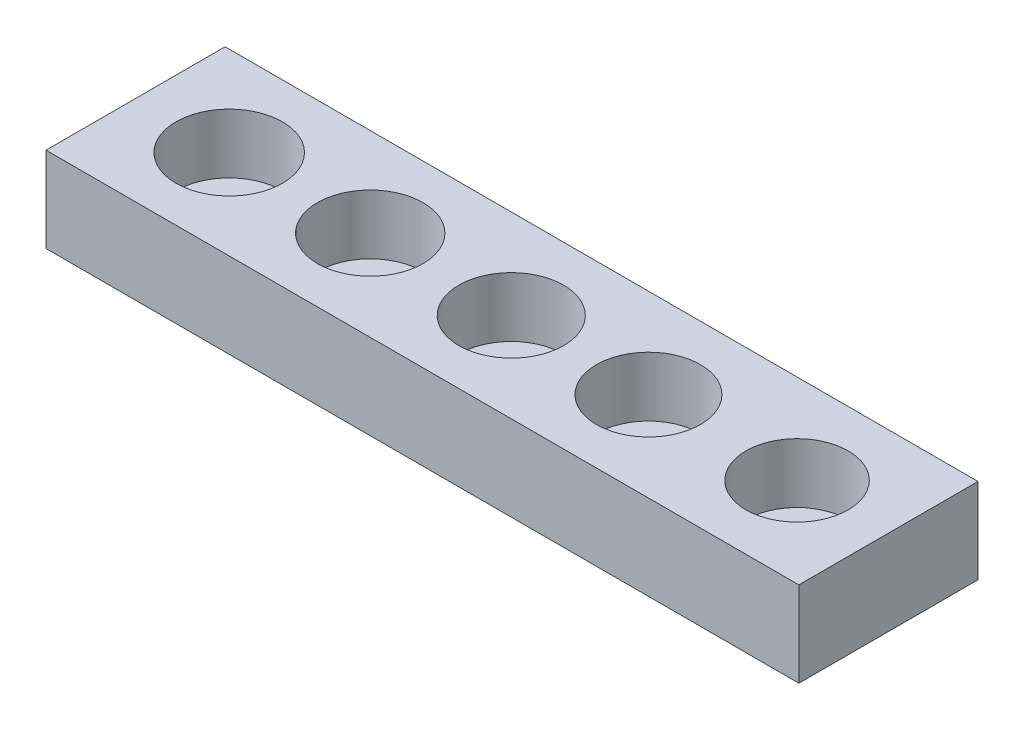
from build123d import *

# Parameters (mm, degrees)
SKETCH4_W           = 44.183790648
SKETCH4_H           = 10.51168125
BOSS_EXTRUDE1_DEPTH = 5
SKETCH5_R           = 3.125
SKETCH5_R_2         = 3.1
SKETCH5_R_3         = 3.075
SKETCH5_R_4         = 3.05
SKETCH5_R_5         = 3
CUT_EXTRUDE1_DEPTH  = 3.5


with BuildPart() as part:
    # Sketch4 → Boss-Extrude1 (new body)
    with BuildSketch(Plane(origin=(0, 0, 0), x_dir=(1, 0, 0), z_dir=(0, 1, 0))):
        Rectangle(SKETCH4_W, SKETCH4_H)
    extrude(amount=BOSS_EXTRUDE1_DEPTH)

    # Sketch5 → Cut-Extrude1 (cut)
    with BuildSketch(Plane(origin=(0, 5, 0), x_dir=(1, 0, 0), z_dir=(0, 1, 0))):
        with Locations(Location((-16.59538934, 0, 0), (0, 0, 270))):
            Circle(SKETCH5_R)
        with Locations(Location((-8.363747216, 0.044488017, 0), (0, 0, 270))):
            Circle(SKETCH5_R_2)
        with Locations(Location((-0.044488017, 0, 0), (0, 0, 270))):
            Circle(SKETCH5_R_3)
        with Locations(Location((8.007843079, 0, 0), (0, 0, 270))):
            Circle(SKETCH5_R_4)
        with Locations(Location((16.727494433, 0, 0), (0, 0, 270))):
            Circle(SKETCH5_R_5)
    extrude(amount=-CUT_EXTRUDE1_DEPTH, mode=Mode.SUBTRACT)


solid = part.part
